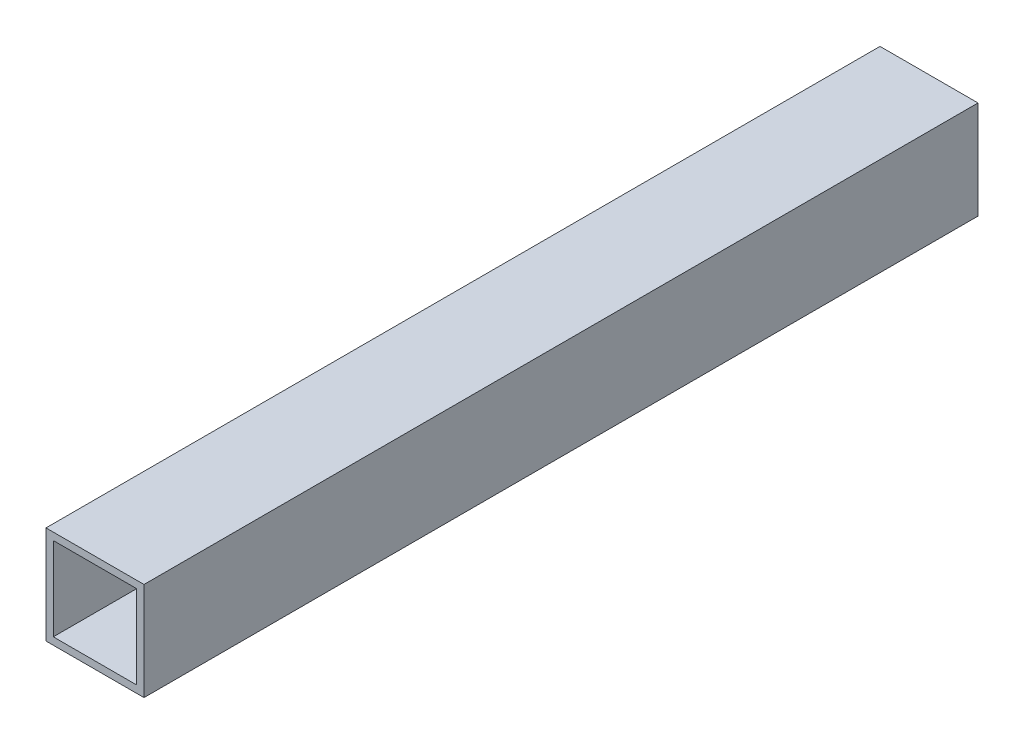
from build123d import *

# Parameters (mm, degrees)
ESQUISSE1_W             = 23.5
ESQUISSE1_H             = 23.5
ESQUISSE1_W_2           = 20
ESQUISSE1_H_2           = 20
BOSS_EXTRU_1_DEPTH      = 200
ESQUISSE2_R             = 7.210256751
ENL_V_MAT_EXTRU_1_DEPTH = 1.75


with BuildPart() as part:
    # Esquisse1 → Boss.-Extru.1 (new body)
    with BuildSketch(Plane.XY):
        Rectangle(ESQUISSE1_W, ESQUISSE1_H)
        Rectangle(ESQUISSE1_W_2, ESQUISSE1_H_2, mode=Mode.SUBTRACT)
    extrude(amount=BOSS_EXTRU_1_DEPTH)

    # Esquisse2 → Enlèv. mat.-Extru.1 (cut)
    with BuildSketch(Plane.ZY.offset(11.75)):
        with Locations((100, 0)):
            Circle(ESQUISSE2_R)
    extrude(amount=-ENL_V_MAT_EXTRU_1_DEPTH, mode=Mode.SUBTRACT)


solid = part.part
